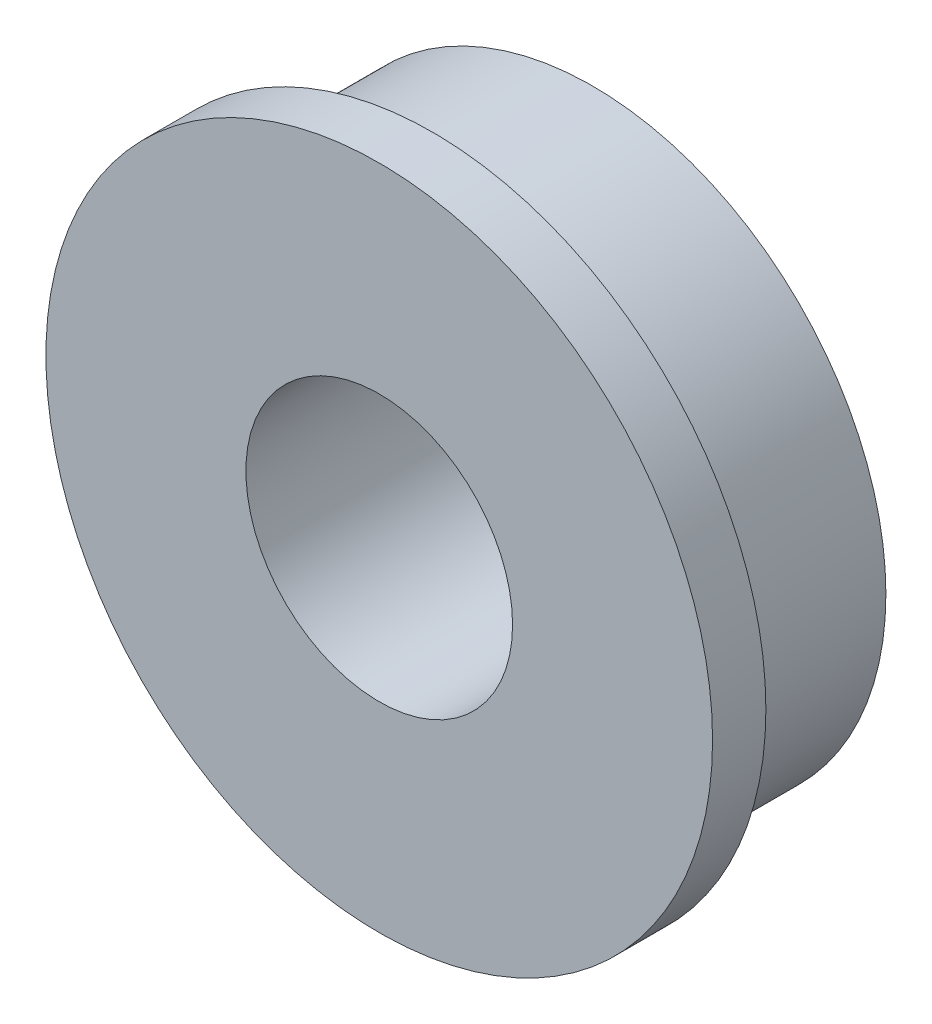
from build123d import *

# Parameters (mm, degrees)
SKETCH_1_R      = 5.5
SKETCH_1_R_2    = 2.5
EXTRUDE_1_DEPTH = 3
SKETCH_2_R      = 6.25
SKETCH_2_R_2    = 2.5
EXTRUDE_2_DEPTH = 1


with BuildPart() as part:
    # 草图1 → 凸台-拉伸1 (new body)
    with BuildSketch(Plane.XY):
        Circle(SKETCH_1_R)
        Circle(SKETCH_1_R_2, mode=Mode.SUBTRACT)
    extrude(amount=EXTRUDE_1_DEPTH)

    # 草图2 → 凸台-拉伸2 (add)
    with BuildSketch(Plane.XY.offset(3)):
        Circle(SKETCH_2_R)
        Circle(SKETCH_2_R_2, mode=Mode.SUBTRACT)
    extrude(amount=EXTRUDE_2_DEPTH)


solid = part.part
